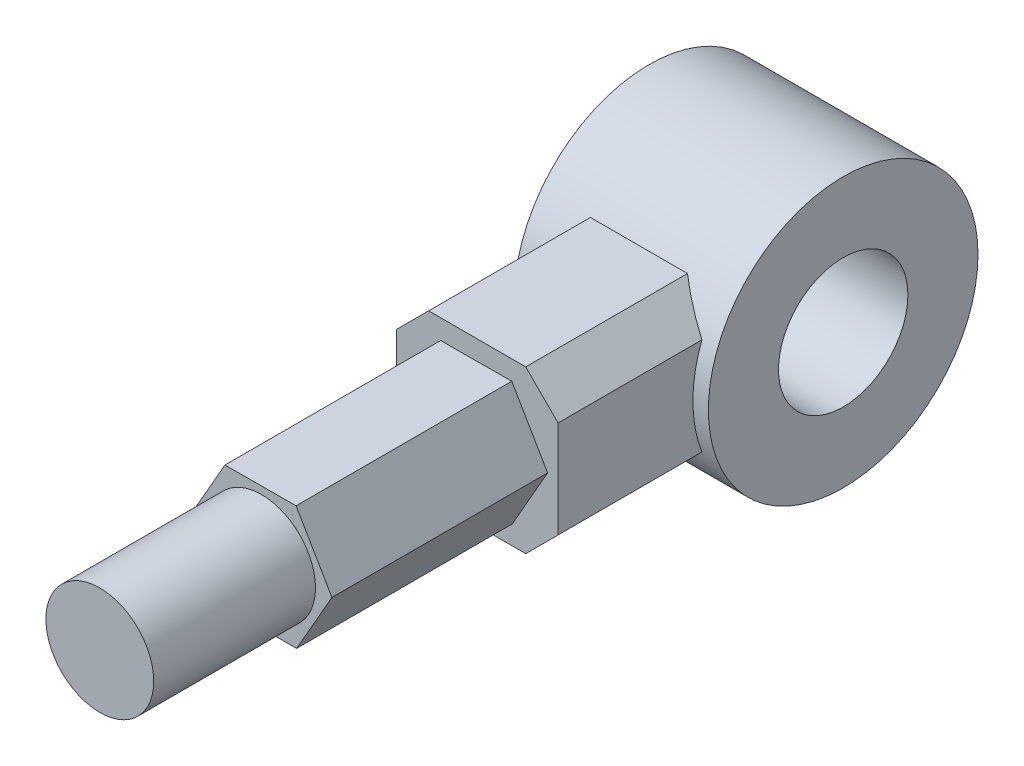
from build123d import *

# Parameters (mm, degrees)
SKETCH1_R               = 12.5
SKETCH1_R_2             = 6
BOSS_EXTRUDE1_DEPTH     = 18
SKETCH2_W               = 15
SKETCH2_H               = 15
BOSS_EXTRUDE2_DEPTH     = 25
BOSS_EXTRUDE3_DEPTH     = 20
CHAMFER1_SIZE           = 3
SKETCH4_R               = 5
BOSS_EXTRUDE4_DEPTH     = 15
CUT_EXTRUDE2_DEPTH      = 64.876834612
CUT_EXTRUDE2_DEPTH_BACK = 64.876834612
SKETCH1_3_R             = 6


with BuildPart() as part:
    # Sketch1 → Boss-Extrude1 (new body)
    with BuildSketch(Plane(origin=(0, 0, 0), x_dir=(0, 0, -1), z_dir=(1, 0, 0))):
        Circle(SKETCH1_R)
        Circle(SKETCH1_R_2, mode=Mode.SUBTRACT)
    extrude(amount=BOSS_EXTRUDE1_DEPTH)

    # Sketch2 → Boss-Extrude2 (add)
    with BuildSketch(Plane.XY):
        with Locations((9.060136008, 0)):
            Rectangle(SKETCH2_W, SKETCH2_H)
    extrude(amount=BOSS_EXTRUDE2_DEPTH)

    # Sketch3 → Boss-Extrude3 (add)
    with BuildSketch(Plane.XY.offset(25)):
        Polygon((12.266098975, 5.700421756), (5.666853814, 5.671037358), (2.392678869, -0.058768796), (5.717749085, -5.759190552), (12.316994245, -5.729806154), (15.591169191, 0), align=None)
    extrude(amount=BOSS_EXTRUDE3_DEPTH)

    # Chamfer1
    chamfer1_edges = [part.edges().sort_by_distance(p)[0] for p in [
        (1.560136008, -7.5, 17.5),
        (16.560136008, -7.5, 17.5),
        (1.560136008, 7.5, 17.5),
        (16.560136008, 7.5, 17.5),
    ]]
    chamfer(chamfer1_edges, length=CHAMFER1_SIZE)

    # Sketch4 → Boss-Extrude4 (add)
    with BuildSketch(Plane.XY.offset(45)):
        with Locations((9.066652134, 0)):
            Circle(SKETCH4_R)
    extrude(amount=BOSS_EXTRUDE4_DEPTH)

    # Sketch1<3> → Cut-Extrude2 (cut, two sides: drawn at the far end of the back side and taken through both)
    with BuildSketch(Plane(origin=(0, 0, 0), x_dir=(0, 0, -1), z_dir=(1, 0, 0)).offset(-CUT_EXTRUDE2_DEPTH_BACK)):
        Circle(SKETCH1_3_R)
    extrude(amount=CUT_EXTRUDE2_DEPTH + CUT_EXTRUDE2_DEPTH_BACK, mode=Mode.SUBTRACT)


solid = part.part
